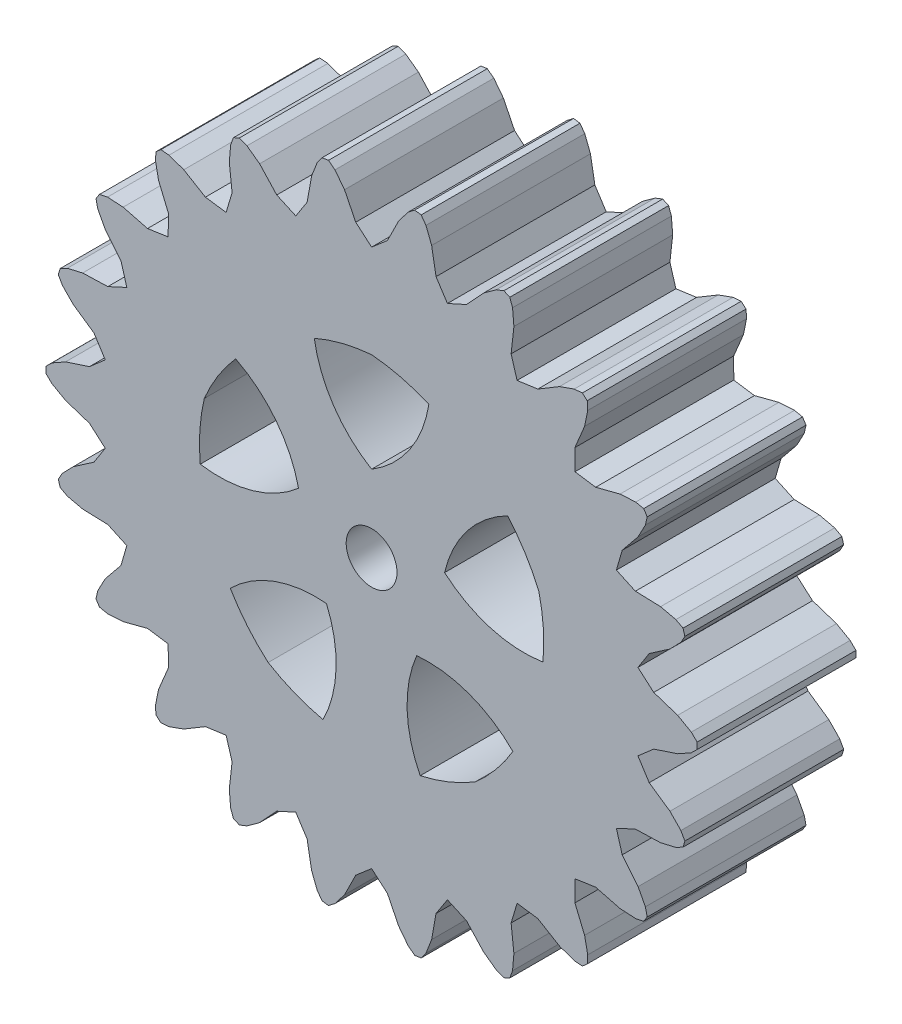
from build123d import *

# Parameters (mm, degrees)
SKETCH1_R               = 20.5
BOSS_EXTRUDE1_DEPTH     = 10
CUT_EXTRUDE1_DEPTH      = 31.66757245
CUT_EXTRUDE2_DEPTH      = 31.66757245
CUT_EXTRUDE2_DEPTH_BACK = 31.66757245
SKETCH4_R               = 1.6
CIRPATTERN1_COUNT       = 22
CUT_EXTRUDE4_DEPTH      = 31.547122362
CIRPATTERN2_COUNT       = 5


with BuildPart() as part:
    # Sketch1 → Boss-Extrude1 (new body)
    with BuildSketch(Plane.XY):
        Circle(SKETCH1_R)
    extrude(amount=BOSS_EXTRUDE1_DEPTH)

    # Sketch2 → Cut-Extrude1 (cut, through all)
    with BuildSketch(Plane.XY):
        Polygon((0, 16.944693036), (-0.998470792, 17.804120424), (-1.704297747, 19.225185361), (-2.306603416, 20.006300526), (-2.715384942, 20.31936723), (0, 24.503722989), (2.715384942, 20.31936723), (2.306603416, 20.006300526), (1.704297747, 19.225185361), (0.998470792, 17.804120424), align=None)
    cut_extrude1 = extrude(amount=CUT_EXTRUDE1_DEPTH, mode=Mode.SUBTRACT)

    # Sketch4 → Cut-Extrude2 (cut, two sides: drawn at the far end of the back side and taken through both)
    with BuildSketch(Plane.XY.offset(10).offset(-CUT_EXTRUDE2_DEPTH_BACK)):
        Circle(SKETCH4_R)
    extrude(amount=CUT_EXTRUDE2_DEPTH + CUT_EXTRUDE2_DEPTH_BACK, mode=Mode.SUBTRACT)

    # CirPattern1: Cut-Extrude1 ×22 about axis
    cirpattern1_axis = Axis((0, 0, 0), (0, 0, 1))
    for i in range(1, CIRPATTERN1_COUNT):
        add(cut_extrude1.rotate(cirpattern1_axis, i * 360 / CIRPATTERN1_COUNT), mode=Mode.SUBTRACT)

    # Sketch5 → Cut-Extrude4 (cut, symmetric)
    with BuildSketch(Plane.XY):
        with BuildLine():
            ThreePointArc((0, 4.833898347), (-2.395996352, 7.102757186), (-3.60768117, 10.172014238))
            ThreePointArc((-3.60768117, 10.172014238), (-1.840915347, 10.772847795), (0, 11.078614242))
            ThreePointArc((0, 11.078614242), (1.840915347, 10.772847795), (3.60768117, 10.172014238))
            ThreePointArc((3.60768117, 10.172014238), (2.395996352, 7.102757186), (0, 4.833898347))
        make_face()
    cut_extrude4 = extrude(amount=CUT_EXTRUDE4_DEPTH, both=True, mode=Mode.SUBTRACT)

    # CirPattern2: Cut-Extrude4 ×5 about axis
    cirpattern2_axis = Axis((0, 0, 0), (0, 0, 1))
    for i in range(1, CIRPATTERN2_COUNT):
        add(cut_extrude4.rotate(cirpattern2_axis, i * 360 / CIRPATTERN2_COUNT), mode=Mode.SUBTRACT)


solid = part.part
